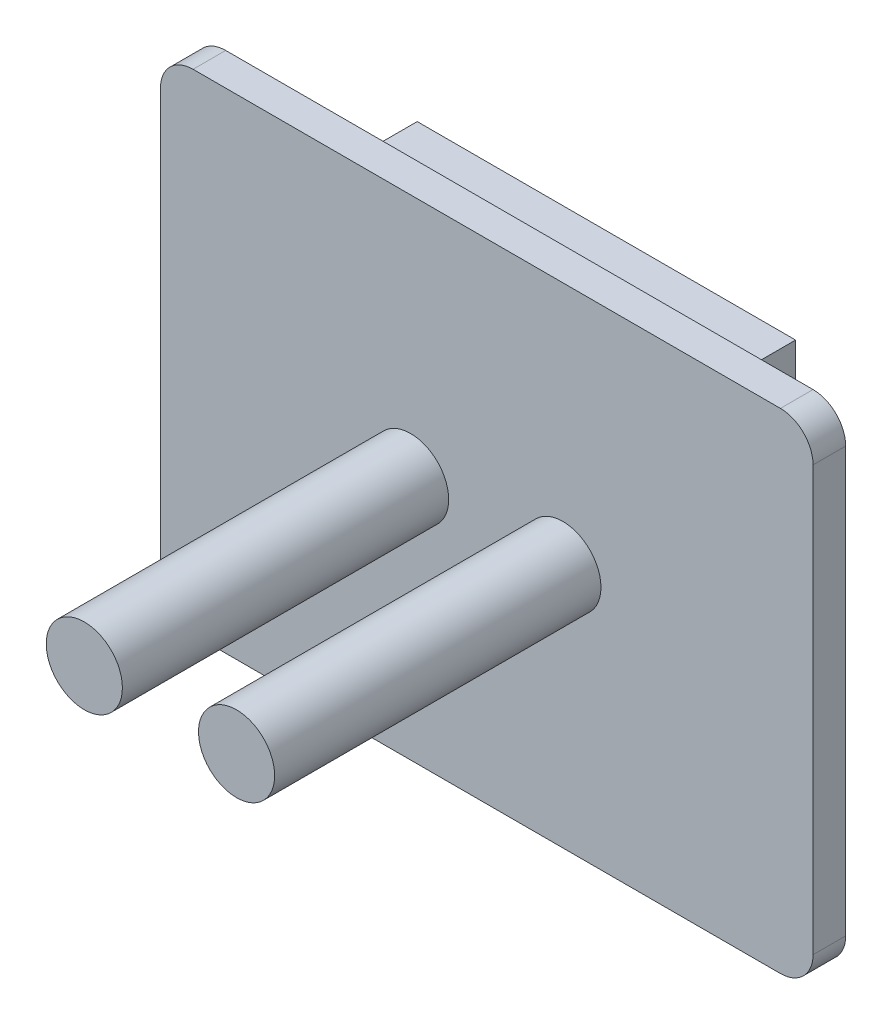
from build123d import *

# Parameters (mm, degrees)
SKETCH1_W            = 600
SKETCH1_H            = 450
BOSS_EXTRUDE1_DEPTH  = 30
FILLET1_R            = 30
SKETCH2_W            = 347.887186226
SKETCH2_H            = 352.796759622
BOSS_EXTRUDE2_DEPTH  = 80
RIB2_REACH           = 385.438
SKETCH3_WALL_W       = 918.175870934
SKETCH3_WALL_H       = 100
SKETCH4_R            = 35
BOSS_EXTRUDE3_DEPTH  = 300
BOSS_EXTRUDE4_DEPTH  = 60
BOSS_EXTRUDE5_DEPTH  = 18
MIRROR3_COPY_1_DEPTH = 18


with BuildPart() as part:
    # Sketch1 → Boss-Extrude1 (new body)
    with BuildSketch(Plane.XY):
        Rectangle(SKETCH1_W, SKETCH1_H)
    extrude(amount=BOSS_EXTRUDE1_DEPTH)

    # Fillet1
    fillet1_edges = [part.edges().sort_by_distance(p)[0] for p in [
        (300, -225, 15),
        (-300, -225, 15),
        (-300, 225, 15),
        (300, 225, 15),
    ]]
    fillet(fillet1_edges, radius=FILLET1_R)

    # Sketch2 → Boss-Extrude2 (add)
    with BuildSketch(Plane(origin=(0, 0, 0), x_dir=(-1, 0, 0), z_dir=(0, 0, -1))):
        Rectangle(SKETCH2_W, SKETCH2_H)
    extrude(amount=BOSS_EXTRUDE2_DEPTH)

    # Sketch3 wall → Rib2 (add, up to next)
    with BuildSketch(Plane(origin=(236.971796557, 0, -40), x_dir=(0.844321344916, 0, 0.535837164182), z_dir=(0.535837164182, 0, -0.844321344916)), mode=Mode.PRIVATE) as rib2_sk1:
        Rectangle(SKETCH3_WALL_W, SKETCH3_WALL_H)
    rib2_tool1 = extrude(rib2_sk1.sketch, amount=-RIB2_REACH, mode=Mode.PRIVATE) - part.part
    rib2 = rib2_tool1.solids().sort_by_distance((236.971796557, 0, -40))[0]
    add(rib2)

    # Mirror1: Rib2 across plane
    add(rib2.mirror(Plane(origin=(0, 0, 0), x_dir=(0, 0, 1), z_dir=(1, 0, 0))))

    # Sketch4 → Boss-Extrude3 (add)
    with BuildSketch(Plane.XY.offset(30)):
        with Locations((-70, 0)):
            Circle(SKETCH4_R)
        with Locations((70, 0)):
            Circle(SKETCH4_R)
    extrude(amount=BOSS_EXTRUDE3_DEPTH)

    # Sketch5 → Boss-Extrude4 (add)
    with BuildSketch(Plane(origin=(0, 0, -80), x_dir=(-1, 0, 0), z_dir=(0, 0, -1))):
        Polygon((86.602540378, 0), (43.301270189, 75), (-43.301270189, 75), (-86.602540378, 0), (-43.301270189, -75), (43.301270189, -75), align=None)
    extrude(amount=BOSS_EXTRUDE4_DEPTH)

    # Sketch6 → Boss-Extrude5 (add)
    with BuildSketch(Plane(origin=(0, 0, 0), x_dir=(-1, 0, 0), z_dir=(0, 0, -1))):
        Polygon((-230.886428661, 176.398379811), (-242.973945963, 197.334573917), (-267.148980569, 197.334573917), (-279.236497871, 176.398379811), (-267.148980569, 155.462185706), (-242.973945963, 155.462185706), align=None)
    boss_extrude5 = extrude(amount=BOSS_EXTRUDE5_DEPTH)

    # Mirror2: Boss-Extrude5 across plane
    add(boss_extrude5.mirror(Plane(origin=(0, 0, 0), x_dir=(0, 0, 1), z_dir=(1, 0, 0))))

    # Mirror3: Boss-Extrude5 across plane
    add(boss_extrude5.mirror(Plane.ZX))

    # Mirror3 copy 1 sketch → Mirror3 copy 1 (add)
    with BuildSketch(Plane(origin=(0, 0, 0), x_dir=(1, 0, 0), z_dir=(0, 0, -1))):
        Polygon((-230.886428661, 176.398379811), (-242.973945963, 197.334573917), (-267.148980569, 197.334573917), (-279.236497871, 176.398379811), (-267.148980569, 155.462185706), (-242.973945963, 155.462185706), align=None)
    extrude(amount=MIRROR3_COPY_1_DEPTH)


solid = part.part
